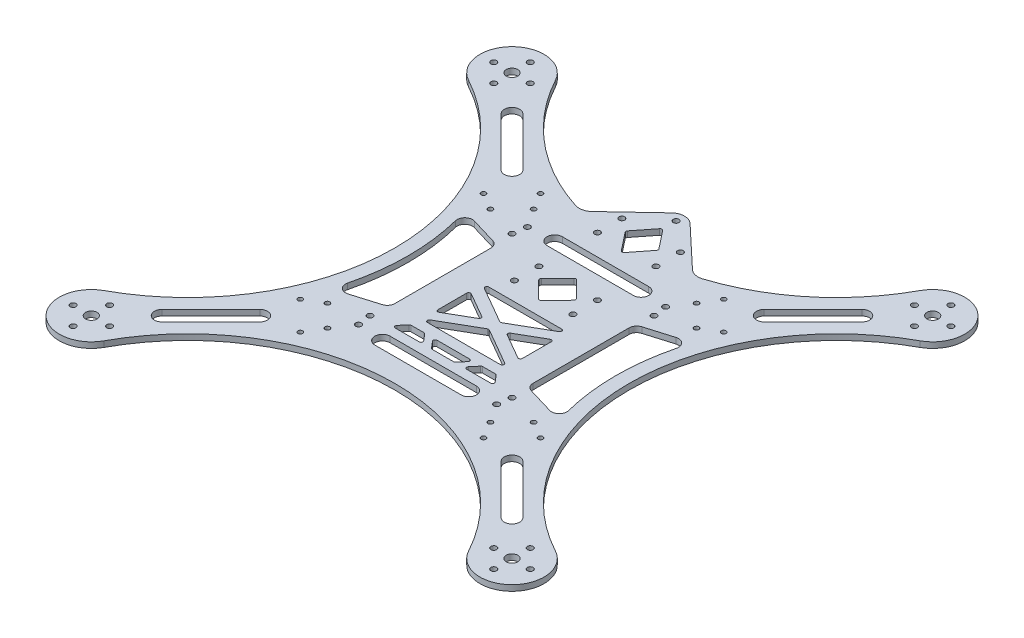
from build123d import *

# Parameters (mm, degrees)
SKETCH_1_R          = 1.5
SKETCH_1_R_2        = 3
SKETCH_1_R_3        = 1.25
EXTRUDE_1_DEPTH     = 3
CUT_EXTRUDE_1_DEPTH = 179.642558234


with BuildPart() as part:
    # 草图1 → 凸台-拉伸1 (new body)
    with BuildSketch(Plane(origin=(0, 0, 0), x_dir=(1, 0, 0), z_dir=(0, 1, 0))):
        with BuildLine():
            Line((-4.79852749, 87.982008218), (-26.179752729, 67.850790856))
            ThreePointArc((-26.179752729, 67.850790856), (-29.438532048, 66.118717469), (-33.12528974, 66.284665004))
            ThreePointArc((-33.12528974, 66.284665004), (-68.968059167, 85.968383486), (-94.923556673, 117.566880962))
            ThreePointArc((-94.923556673, 117.566880962), (-121.41023433, 121.41023433), (-117.566880962, 94.923556673))
            ThreePointArc((-117.566880962, 94.923556673), (-61.079193942, 0), (-117.566880962, -94.923556673))
            ThreePointArc((-117.566880962, -94.923556673), (-121.41023433, -121.41023433), (-94.923556673, -117.566880962))
            ThreePointArc((-94.923556673, -117.566880962), (0, -61.079193942), (94.923556673, -117.566880962))
            ThreePointArc((94.923556673, -117.566880962), (121.41023433, -121.41023433), (117.566880962, -94.923556673))
            ThreePointArc((117.566880962, -94.923556673), (61.079193942, 0), (117.566880962, 94.923556673))
            ThreePointArc((117.566880962, 94.923556673), (121.41023433, 121.41023433), (94.923556673, 117.566880962))
            ThreePointArc((94.923556673, 117.566880962), (68.968059167, 85.968383486), (33.12528974, 66.284665004))
            ThreePointArc((33.12528974, 66.284665004), (29.438532048, 66.118717469), (26.179752729, 67.850790856))
            Line((26.179752729, 67.850790856), (4.79852749, 87.982008218))
            ThreePointArc((4.79852749, 87.982008218), (0, 89.885525713), (-4.79852749, 87.982008218))
        make_face()
        with Locations(Location((0, 85.5, 0), (0, 0, 270))):
            Circle(SKETCH_1_R, mode=Mode.SUBTRACT)
        with Locations(Location((-15.25, 59.75, 0), (0, 0, 270))):
            Circle(SKETCH_1_R, mode=Mode.SUBTRACT)
        with Locations(Location((15.25, 59.75, 0), (0, 0, 270))):
            Circle(SKETCH_1_R, mode=Mode.SUBTRACT)
        with Locations(Location((15.25, 29.25, 0), (0, 0, 270))):
            Circle(SKETCH_1_R, mode=Mode.SUBTRACT)
        with Locations(Location((-15.25, 29.25, 0), (0, 0, 270))):
            Circle(SKETCH_1_R, mode=Mode.SUBTRACT)
        with Locations(Location((-15.25, 72.5, 0), (0, 0, 270))):
            Circle(SKETCH_1_R, mode=Mode.SUBTRACT)
        with Locations(Location((15.25, 72.5, 0), (0, 0, 270))):
            Circle(SKETCH_1_R, mode=Mode.SUBTRACT)
        with Locations(Location((-15.25, 16.5, 0), (0, 0, 270))):
            Circle(SKETCH_1_R, mode=Mode.SUBTRACT)
        with Locations(Location((15.25, 16.5, 0), (0, 0, 270))):
            Circle(SKETCH_1_R, mode=Mode.SUBTRACT)
        with Locations(Location((-109.601551084, 119.101551084, 0), (0, 0, 270))):
            Circle(SKETCH_1_R, mode=Mode.SUBTRACT)
        with Locations(Location((-119.101551084, 109.601551084, 0), (0, 0, 270))):
            Circle(SKETCH_1_R, mode=Mode.SUBTRACT)
        with Locations(Location((-109.601551084, 100.101551084, 0), (0, 0, 270))):
            Circle(SKETCH_1_R, mode=Mode.SUBTRACT)
        with Locations(Location((-100.101551084, 109.601551084, 0), (0, 0, 270))):
            Circle(SKETCH_1_R, mode=Mode.SUBTRACT)
        with Locations(Location((-109.601551084, 109.601551084, 0), (0, 0, 270))):
            Circle(SKETCH_1_R_2, mode=Mode.SUBTRACT)
        with Locations(Location((109.601551084, 119.101551084, 0), (0, 0, 270))):
            Circle(SKETCH_1_R, mode=Mode.SUBTRACT)
        with Locations(Location((109.601551084, 109.601551084, 0), (0, 0, 270))):
            Circle(SKETCH_1_R_2, mode=Mode.SUBTRACT)
        with Locations(Location((119.101551084, 109.601551084, 0), (0, 0, 270))):
            Circle(SKETCH_1_R, mode=Mode.SUBTRACT)
        with Locations(Location((109.601551084, 100.101551084, 0), (0, 0, 270))):
            Circle(SKETCH_1_R, mode=Mode.SUBTRACT)
        with Locations(Location((100.101551084, 109.601551084, 0), (0, 0, 270))):
            Circle(SKETCH_1_R, mode=Mode.SUBTRACT)
        with Locations(Location((119.101551084, -109.601551084, 0), (0, 0, 270))):
            Circle(SKETCH_1_R, mode=Mode.SUBTRACT)
        with Locations(Location((109.601551084, -109.601551084, 0), (0, 0, 270))):
            Circle(SKETCH_1_R_2, mode=Mode.SUBTRACT)
        with Locations(Location((109.601551084, -119.101551084, 0), (0, 0, 270))):
            Circle(SKETCH_1_R, mode=Mode.SUBTRACT)
        with Locations(Location((100.101551084, -109.601551084, 0), (0, 0, 270))):
            Circle(SKETCH_1_R, mode=Mode.SUBTRACT)
        with Locations(Location((109.601551084, -100.101551084, 0), (0, 0, 270))):
            Circle(SKETCH_1_R, mode=Mode.SUBTRACT)
        with Locations(Location((-109.601551084, -119.101551084, 0), (0, 0, 270))):
            Circle(SKETCH_1_R, mode=Mode.SUBTRACT)
        with Locations(Location((-109.601551084, -109.601551084, 0), (0, 0, 270))):
            Circle(SKETCH_1_R_2, mode=Mode.SUBTRACT)
        with Locations(Location((-119.101551084, -109.601551084, 0), (0, 0, 270))):
            Circle(SKETCH_1_R, mode=Mode.SUBTRACT)
        with Locations(Location((-109.601551084, -100.101551084, 0), (0, 0, 270))):
            Circle(SKETCH_1_R, mode=Mode.SUBTRACT)
        with Locations(Location((-100.101551084, -109.601551084, 0), (0, 0, 270))):
            Circle(SKETCH_1_R, mode=Mode.SUBTRACT)
        with Locations(Location((-36, 44, 0), (0, 0, 270))):
            Circle(SKETCH_1_R, mode=Mode.SUBTRACT)
        with Locations(Location((36, 44, 0), (0, 0, 270))):
            Circle(SKETCH_1_R, mode=Mode.SUBTRACT)
        with Locations(Location((-36, -44, 0), (0, 0, 270))):
            Circle(SKETCH_1_R, mode=Mode.SUBTRACT)
        with Locations(Location((36, -44, 0), (0, 0, 270))):
            Circle(SKETCH_1_R, mode=Mode.SUBTRACT)
        with Locations(Location((-62.578950135, 47.72970773, 0), (0, 0, 270))):
            Circle(SKETCH_1_R_3, mode=Mode.SUBTRACT)
        with Locations(Location((-53.716204775, 42.450317466, 0), (0, 0, 270))):
            Circle(SKETCH_1_R_3, mode=Mode.SUBTRACT)
        with Locations(Location((-42.450317466, 53.716204775, 0), (0, 0, 270))):
            Circle(SKETCH_1_R_3, mode=Mode.SUBTRACT)
        with Locations(Location((-47.72970773, 62.578950135, 0), (0, 0, 270))):
            Circle(SKETCH_1_R_3, mode=Mode.SUBTRACT)
        with Locations(Location((47.72970773, 62.578950135, 0), (0, 0, 270))):
            Circle(SKETCH_1_R_3, mode=Mode.SUBTRACT)
        with Locations(Location((62.578950135, 47.72970773, 0), (0, 0, 270))):
            Circle(SKETCH_1_R_3, mode=Mode.SUBTRACT)
        with Locations(Location((42.450317466, 53.716204775, 0), (0, 0, 270))):
            Circle(SKETCH_1_R_3, mode=Mode.SUBTRACT)
        with Locations(Location((53.716204775, 42.450317466, 0), (0, 0, 270))):
            Circle(SKETCH_1_R_3, mode=Mode.SUBTRACT)
        with Locations(Location((62.578950135, -47.72970773, 0), (0, 0, 270))):
            Circle(SKETCH_1_R_3, mode=Mode.SUBTRACT)
        with Locations(Location((47.72970773, -62.578950135, 0), (0, 0, 270))):
            Circle(SKETCH_1_R_3, mode=Mode.SUBTRACT)
        with Locations(Location((53.716204775, -42.450317466, 0), (0, 0, 270))):
            Circle(SKETCH_1_R_3, mode=Mode.SUBTRACT)
        with Locations(Location((42.450317466, -53.716204775, 0), (0, 0, 270))):
            Circle(SKETCH_1_R_3, mode=Mode.SUBTRACT)
        with Locations(Location((-47.72970773, -62.578950135, 0), (0, 0, 270))):
            Circle(SKETCH_1_R_3, mode=Mode.SUBTRACT)
        with Locations(Location((-62.578950135, -47.72970773, 0), (0, 0, 270))):
            Circle(SKETCH_1_R_3, mode=Mode.SUBTRACT)
        with Locations(Location((-42.450317466, -53.716204775, 0), (0, 0, 270))):
            Circle(SKETCH_1_R_3, mode=Mode.SUBTRACT)
        with Locations(Location((-53.716204775, -42.450317466, 0), (0, 0, 270))):
            Circle(SKETCH_1_R_3, mode=Mode.SUBTRACT)
        with Locations(Location((37, 37, 0), (0, 0, 270))):
            Circle(SKETCH_1_R, mode=Mode.SUBTRACT)
        with Locations(Location((-37, -37, 0), (0, 0, 270))):
            Circle(SKETCH_1_R, mode=Mode.SUBTRACT)
        with Locations(Location((37, -37, 0), (0, 0, 270))):
            Circle(SKETCH_1_R, mode=Mode.SUBTRACT)
        with Locations(Location((-37, 37, 0), (0, 0, 270))):
            Circle(SKETCH_1_R, mode=Mode.SUBTRACT)
    extrude(amount=EXTRUDE_1_DEPTH)

    # 草图2 → 切除-拉伸1 (cut, through all)
    with BuildSketch(Plane(origin=(0, 3, 0), x_dir=(1, 0, 0), z_dir=(0, 1, 0))):
        with BuildLine():
            Line((-52.544368532, 32.915252326), (-38.856821203, 28.833163477))
            ThreePointArc((-38.856821203, 28.833163477), (-36.792764805, 27.390322657), (-36, 25))
            Line((-36, 25), (-36, -25))
            ThreePointArc((-36, -25), (-36.792764805, -27.390322657), (-38.856821203, -28.833163477))
            Line((-38.856821203, -28.833163477), (-52.544368532, -32.915252326))
            ThreePointArc((-52.544368532, -32.915252326), (-56.454589608, -31.970596599), (-57.566258139, -28.104539644))
            ThreePointArc((-57.566258139, -28.104539644), (-54.079193942, 0), (-57.566258139, 28.104539644))
            ThreePointArc((-57.566258139, 28.104539644), (-56.454589608, 31.970596599), (-52.544368532, 32.915252326))
        make_face()
        with BuildLine():
            Line((36, 25), (36, -25))
            ThreePointArc((36, -25), (36.792764805, -27.390322657), (38.856821203, -28.833163477))
            Line((38.856821203, -28.833163477), (52.544368532, -32.915252326))
            ThreePointArc((52.544368532, -32.915252326), (56.454589608, -31.970596599), (57.566258139, -28.104539644))
            ThreePointArc((57.566258139, -28.104539644), (54.079193942, 0), (57.566258139, 28.104539644))
            ThreePointArc((57.566258139, 28.104539644), (56.454589608, 31.970596599), (52.544368532, 32.915252326))
            Line((52.544368532, 32.915252326), (38.856821203, 28.833163477))
            ThreePointArc((38.856821203, 28.833163477), (36.792764805, 27.390322657), (36, 25))
        make_face()
        with BuildLine():
            Line((-22.5, 48.75), (22.5, 48.75))
            ThreePointArc((22.5, 48.75), (26.5, 44.75), (22.5, 40.75))
            Line((22.5, 40.75), (-22.5, 40.75))
            ThreePointArc((-22.5, 40.75), (-26.5, 44.75), (-22.5, 48.75))
        make_face()
        with BuildLine():
            Line((-22.5, -41), (22.5, -41))
            ThreePointArc((22.5, -41), (26.5, -45), (22.5, -49))
            Line((22.5, -49), (-22.5, -49))
            ThreePointArc((-22.5, -49), (-26.5, -45), (-22.5, -41))
        make_face()
        with BuildLine():
            Line((-19, 6.898607231), (19, 6.898607231))
            ThreePointArc((19, 6.898607231), (19.940445649, 6.176770458), (19.486306046, 5.081670661))
            Line((19.486306046, 5.081670661), (0.499519029, -5.866302914))
            ThreePointArc((0.499519029, -5.866302914), (0, -6), (-0.499519029, -5.866302914))
            Line((-0.499519029, -5.866302914), (-19.486306046, 5.081670661))
            ThreePointArc((-19.486306046, 5.081670661), (-19.940445649, 6.176770458), (-19, 6.898607231))
        make_face()
        with BuildLine():
            Line((-0.499519029, -12.336482623), (-19.486306046, -23.284456198))
            ThreePointArc((-19.486306046, -23.284456198), (-19.940445649, -24.379555996), (-19, -25.101392769))
            Line((-19, -25.101392769), (19, -25.101392769))
            ThreePointArc((19, -25.101392769), (19.940445649, -24.379555996), (19.486306046, -23.284456198))
            Line((19.486306046, -23.284456198), (0.499519029, -12.336482623))
            ThreePointArc((0.499519029, -12.336482623), (0, -12.202785538), (-0.499519029, -12.336482623))
        make_face()
        with BuildLine():
            Line((-7.493425222, -8.235089854), (-20.500480971, -0.735089854))
            ThreePointArc((-20.500480971, -0.735089854), (-21.500240428, -0.735506221), (-22, -1.601392769))
            Line((-22, -1.601392769), (-22, -16.601392769))
            ThreePointArc((-22, -16.601392769), (-21.500240428, -17.467279317), (-20.500480971, -17.467695683))
            Line((-20.500480971, -17.467695683), (-7.493425222, -9.967695683))
            ThreePointArc((-7.493425222, -9.967695683), (-6.992944251, -9.101392769), (-7.493425222, -8.235089854))
        make_face()
        with BuildLine():
            Line((22, -1.601392769), (22, -16.601392769))
            ThreePointArc((22, -16.601392769), (21.500240428, -17.467279317), (20.500480971, -17.467695683))
            Line((20.500480971, -17.467695683), (7.493425222, -9.967695683))
            ThreePointArc((7.493425222, -9.967695683), (6.992944251, -9.101392769), (7.493425222, -8.235089854))
            Line((7.493425222, -8.235089854), (20.500480971, -0.735089854))
            ThreePointArc((20.500480971, -0.735089854), (21.500240428, -0.735506221), (22, -1.601392769))
        make_face()
        with BuildLine():
            Line((-93.993770887, -88.336916637), (-68.537926764, -62.881072515))
            ThreePointArc((-68.537926764, -62.881072515), (-62.881072515, -62.881072515), (-62.881072515, -68.537926764))
            Line((-62.881072515, -68.537926764), (-88.336916637, -93.993770887))
            ThreePointArc((-88.336916637, -93.993770887), (-93.993770887, -93.993770887), (-93.993770887, -88.336916637))
        make_face()
        with BuildLine():
            Line((-88.336916637, 93.993770887), (-62.881072515, 68.537926764))
            ThreePointArc((-62.881072515, 68.537926764), (-62.881072515, 62.881072515), (-68.537926764, 62.881072515))
            Line((-68.537926764, 62.881072515), (-93.993770887, 88.336916637))
            ThreePointArc((-93.993770887, 88.336916637), (-93.993770887, 93.993770887), (-88.336916637, 93.993770887))
        make_face()
        with BuildLine():
            Line((93.993770887, 88.336916637), (68.537926764, 62.881072515))
            ThreePointArc((68.537926764, 62.881072515), (62.881072515, 62.881072515), (62.881072515, 68.537926764))
            Line((62.881072515, 68.537926764), (88.336916637, 93.993770887))
            ThreePointArc((88.336916637, 93.993770887), (93.993770887, 93.993770887), (93.993770887, 88.336916637))
        make_face()
        with BuildLine():
            Line((88.336916637, -93.993770887), (62.881072515, -68.537926764))
            ThreePointArc((62.881072515, -68.537926764), (62.881072515, -62.881072515), (68.537926764, -62.881072515))
            Line((68.537926764, -62.881072515), (93.993770887, -88.336916637))
            ThreePointArc((93.993770887, -88.336916637), (93.993770887, -93.993770887), (88.336916637, -93.993770887))
        make_face()
        with BuildLine():
            Line((-0.785714286, 77.75200882), (-8.173241051, 68.368589574))
            ThreePointArc((-8.173241051, 68.368589574), (-8.387526765, 67.75), (-8.173241051, 67.131410426))
            Line((-8.173241051, 67.131410426), (-0.785714286, 57.74799118))
            ThreePointArc((-0.785714286, 57.74799118), (0, 57.366580754), (0.785714286, 57.74799118))
            Line((0.785714286, 57.74799118), (8.173241051, 67.131410426))
            ThreePointArc((8.173241051, 67.131410426), (8.387526765, 67.75), (8.173241051, 68.368589574))
            Line((8.173241051, 68.368589574), (0.785714286, 77.75200882))
            ThreePointArc((0.785714286, 77.75200882), (0, 78.133419246), (-0.785714286, 77.75200882))
        make_face()
        with BuildLine():
            Line((-24.831538509, -36), (-12.417541073, -36))
            ThreePointArc((-12.417541073, -36), (-11.509449741, -35.418772173), (-11.656974312, -34.350740266))
            Line((-11.656974312, -34.350740266), (-14.558203944, -30.952133035))
            ThreePointArc((-14.558203944, -30.952133035), (-14.899998532, -30.693301437), (-15.318770706, -30.601392769))
            Line((-15.318770706, -30.601392769), (-21.930308876, -30.601392769))
            ThreePointArc((-21.930308876, -30.601392769), (-22.34908105, -30.693301437), (-22.690875637, -30.952133035))
            Line((-22.690875637, -30.952133035), (-25.59210527, -34.350740266))
            ThreePointArc((-25.59210527, -34.350740266), (-25.73962984, -35.418772173), (-24.831538509, -36))
        make_face()
        with BuildLine():
            Line((0.714285714, 14.479014804), (9.112244685, 23.050145788))
            ThreePointArc((9.112244685, 23.050145788), (9.397958971, 23.75), (9.112244685, 24.449854212))
            Line((9.112244685, 24.449854212), (0.714285714, 33.020985196))
            ThreePointArc((0.714285714, 33.020985196), (0, 33.321130983), (-0.714285714, 33.020985196))
            Line((-0.714285714, 33.020985196), (-9.112244685, 24.449854212))
            ThreePointArc((-9.112244685, 24.449854212), (-9.397958971, 23.75), (-9.112244685, 23.050145788))
            Line((-9.112244685, 23.050145788), (-0.714285714, 14.479014804))
            ThreePointArc((-0.714285714, 14.479014804), (0, 14.178869017), (0.714285714, 14.479014804))
        make_face()
        with BuildLine():
            Line((22.690875637, -30.952133035), (25.59210527, -34.350740266))
            ThreePointArc((25.59210527, -34.350740266), (25.73962984, -35.418772173), (24.831538509, -36))
            Line((24.831538509, -36), (12.437442977, -36))
            ThreePointArc((12.437442977, -36), (11.529351645, -35.418772173), (11.676876215, -34.350740266))
            Line((11.676876215, -34.350740266), (14.578105848, -30.952133035))
            ThreePointArc((14.578105848, -30.952133035), (14.919900436, -30.693301437), (15.338672609, -30.601392769))
            Line((15.338672609, -30.601392769), (21.930308876, -30.601392769))
            ThreePointArc((21.930308876, -30.601392769), (22.34908105, -30.693301437), (22.690875637, -30.952133035))
        make_face()
        with BuildLine():
            Line((-9.19165846, -32.250652502), (-6.290428828, -35.649259734))
            ThreePointArc((-6.290428828, -35.649259734), (-5.94863424, -35.908091332), (-5.529862066, -36))
            Line((-5.529862066, -36), (5.547825037, -36))
            ThreePointArc((5.547825037, -36), (5.96659721, -35.908091332), (6.308391798, -35.649259734))
            Line((6.308391798, -35.649259734), (9.209621431, -32.250652502))
            ThreePointArc((9.209621431, -32.250652502), (9.357146001, -31.182620596), (8.449054669, -30.601392769))
            Line((8.449054669, -30.601392769), (-8.431091699, -30.601392769))
            ThreePointArc((-8.431091699, -30.601392769), (-9.33918303, -31.182620596), (-9.19165846, -32.250652502))
        make_face()
    extrude(amount=-CUT_EXTRUDE_1_DEPTH, mode=Mode.SUBTRACT)


solid = part.part
